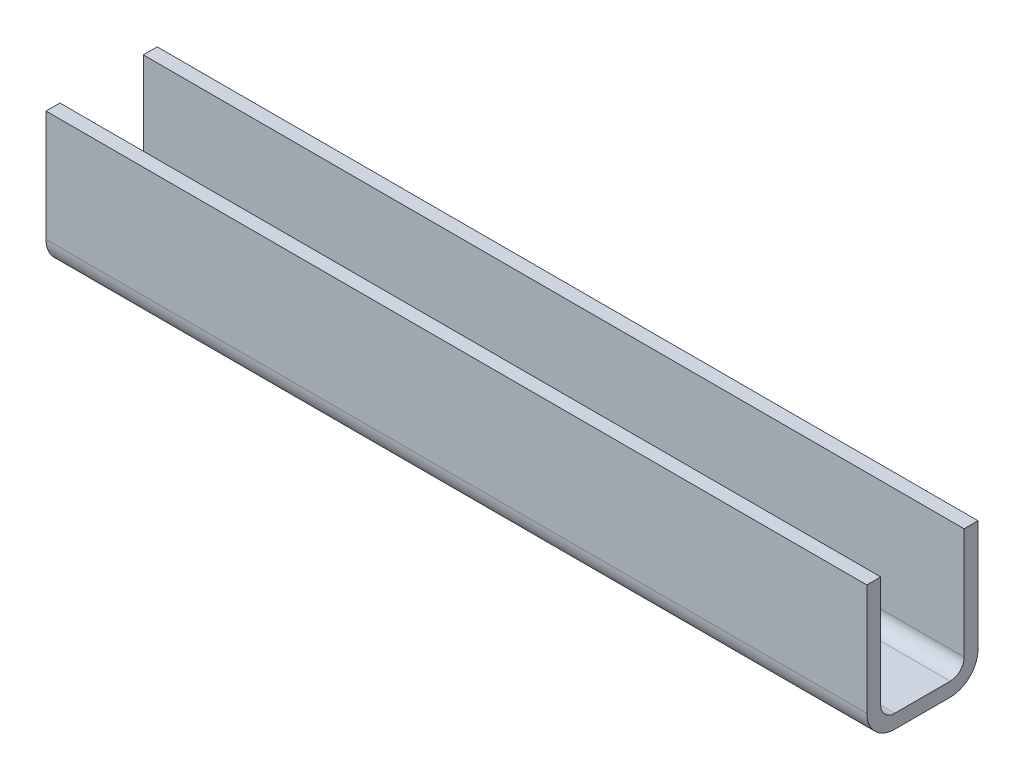
from build123d import *

# Parameters (mm, degrees)
TUBO_RECTANGULAR_3_X_2_X_0_25_1_DEPTH = 375
CROQUIS3_W                            = 375
CROQUIS3_H                            = 12.7
CORTAR_EXTRUIR1_DEPTH                 = 78


with BuildPart() as part:
    # Sketch1 → Tubo rectangular 3 X 2 X 0.25(1) (new body)
    with BuildSketch(Plane(origin=(0, 0, 0), x_dir=(0, 0, -1), z_dir=(1, 0, 0))):
        with BuildLine():
            Line((-12.699978, -38.1), (12.699978, -38.1))
            ThreePointArc((12.699978, -38.1), (21.680234121, -34.380256121), (25.399978, -25.4))
            Line((25.399978, -25.4), (25.399978, 25.4))
            ThreePointArc((25.399978, 25.4), (21.680234121, 34.380256121), (12.699978, 38.1))
            Line((12.699978, 38.1), (-12.699978, 38.1))
            ThreePointArc((-12.699978, 38.1), (-21.680234121, 34.380256121), (-25.399978, 25.4))
            Line((-25.399978, 25.4), (-25.399978, -25.4))
            ThreePointArc((-25.399978, -25.4), (-21.680234121, -34.380256121), (-12.699978, -38.1))
        make_face()
        with BuildLine():
            Line((-12.699978, -31.75), (12.699978, -31.75))
            ThreePointArc((12.699978, -31.75), (17.190106061, -29.890128061), (19.049978, -25.4))
            Line((19.049978, -25.4), (19.049978, 25.4))
            ThreePointArc((19.049978, 25.4), (17.190106061, 29.890128061), (12.699978, 31.75))
            Line((12.699978, 31.75), (-12.699978, 31.75))
            ThreePointArc((-12.699978, 31.75), (-17.190106061, 29.890128061), (-19.049978, 25.4))
            Line((-19.049978, 25.4), (-19.049978, -25.4))
            ThreePointArc((-19.049978, -25.4), (-17.190106061, -29.890128061), (-12.699978, -31.75))
        make_face(mode=Mode.SUBTRACT)
    extrude(amount=TUBO_RECTANGULAR_3_X_2_X_0_25_1_DEPTH)

    # Croquis3 → Cortar-Extruir1 (cut)
    with BuildSketch(Plane(origin=(0, 0, -25.399978), x_dir=(-1, 0, 0), z_dir=(0, 0, -1))):
        with Locations((-187.5, 31.75)):
            Rectangle(CROQUIS3_W, CROQUIS3_H)
    extrude(amount=-CORTAR_EXTRUIR1_DEPTH, mode=Mode.SUBTRACT)


solid = part.part
